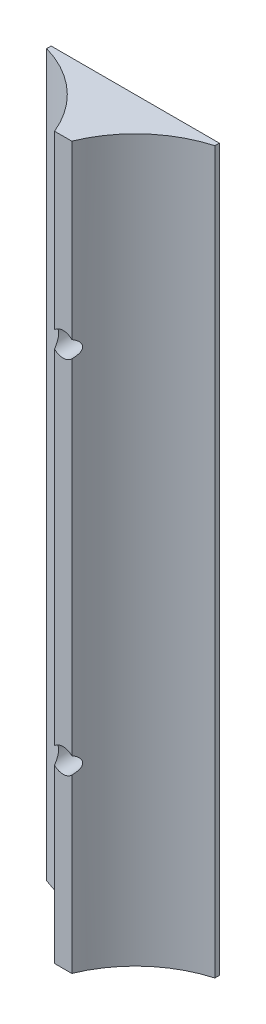
from build123d import *

# Parameters (mm, degrees)
BOSS_EXTRUDE1_DEPTH                       = 60
TAPPED_HOLE_FOR_M2_5X0_45_HELICOIL1_D     = 2.55
TAPPED_HOLE_FOR_M2_5X0_45_HELICOIL1_DEPTH = 4
TAPPED_HOLE_FOR_M2_5X0_45_HELICOIL1_TIP   = 0.766097289
F_2_0MM_DOWEL_HOLE1_D                     = 2
F_2_0MM_DOWEL_HOLE1_DEPTH                 = 6.45
F_2_0MM_DOWEL_HOLE1_TIP                   = 0.600860619


with BuildPart() as part:
    # Sketch1 → Boss-Extrude1 (new body)
    with BuildSketch(Plane(origin=(0, 0, 0), x_dir=(1, 0, 0), z_dir=(0, 1, 0))):
        with BuildLine():
            Line((-0.716915426, 0), (0.716915426, 0))
            ThreePointArc((0.716915426, 0), (3.210792252, 3.53742677), (7, 5.629008568))
            Line((7, 5.629008568), (7, 6))
            Line((7, 6), (-7, 6))
            Line((-7, 6), (-7, 5.629008568))
            ThreePointArc((-7, 5.629008568), (-3.210792252, 3.53742677), (-0.716915426, 0))
        make_face()
    extrude(amount=BOSS_EXTRUDE1_DEPTH)

    # Tapped Hole for M2.5x0.45 Helicoil1
    with Locations(Plane(origin=(0, 45, -6), x_dir=(-1, 0, 0), z_dir=(0, 0, -1))):
        with Locations((0, 0), (0, -30)):
            Hole(TAPPED_HOLE_FOR_M2_5X0_45_HELICOIL1_D / 2, depth=TAPPED_HOLE_FOR_M2_5X0_45_HELICOIL1_DEPTH)
            with Locations((0, 0, -(TAPPED_HOLE_FOR_M2_5X0_45_HELICOIL1_DEPTH + TAPPED_HOLE_FOR_M2_5X0_45_HELICOIL1_TIP / 2))):  # 118° drill point
                Cone(0, TAPPED_HOLE_FOR_M2_5X0_45_HELICOIL1_D / 2, TAPPED_HOLE_FOR_M2_5X0_45_HELICOIL1_TIP, mode=Mode.SUBTRACT)

    # Ø2.0mm Dowel Hole1
    with Locations(Plane(origin=(0, 45, -6), x_dir=(-1, 0, 0), z_dir=(0, 0, -1))):
        with Locations((0, 0), (0, -30)):
            Hole(F_2_0MM_DOWEL_HOLE1_D / 2, depth=F_2_0MM_DOWEL_HOLE1_DEPTH)
            with Locations((0, 0, -(F_2_0MM_DOWEL_HOLE1_DEPTH + F_2_0MM_DOWEL_HOLE1_TIP / 2))):  # 118° drill point
                Cone(0, F_2_0MM_DOWEL_HOLE1_D / 2, F_2_0MM_DOWEL_HOLE1_TIP, mode=Mode.SUBTRACT)


solid = part.part
